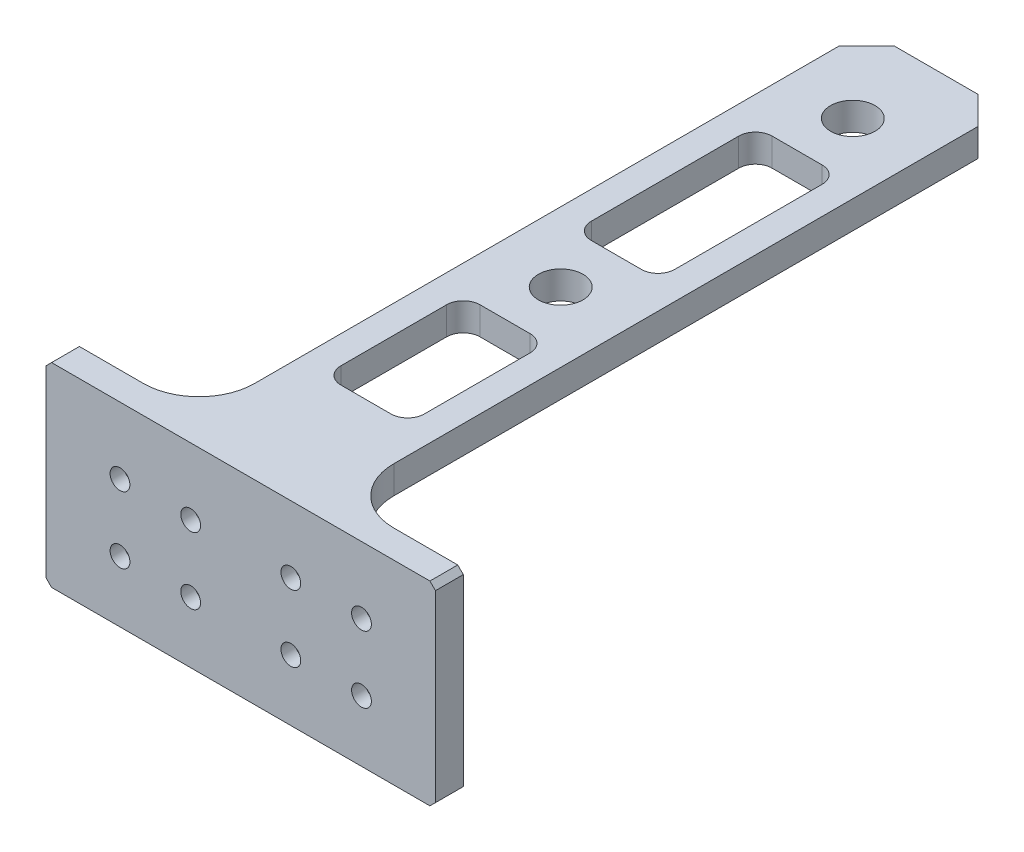
from build123d import *

# Parameters (mm, degrees)
BOSS_EXTRUDE1_DEPTH = 5
CHAMFER1_SIZE       = 5
BOSS_EXTRUDE3_DEPTH = 30
HOLE1_D             = 3.556
HOLE1_CBORE_D       = 6.858
HOLE1_CBORE_DEPTH   = 2.54
SKETCH9_R           = 4
CUT_EXTRUDE2_DEPTH  = 78.661122835
SKETCH10_W          = 15
SKETCH10_H          = 32.5
CUT_EXTRUDE3_DEPTH  = 78.661122835
CUT_EXTRUDE4_DEPTH  = 79.819413852
FILLET5_R           = 10
SKETCH13_W          = 15
SKETCH13_H          = 25
CUT_EXTRUDE5_DEPTH  = 78.661122835
FILLET3_R           = 3
CHAMFER3_SIZE       = 1


with BuildPart() as part:
    # Sketch1 → Boss-Extrude1 (new body)
    with BuildSketch(Plane(origin=(0, 0, 0), x_dir=(1, 0, 0), z_dir=(0, 1, 0))):
        Polygon((-12.5, 62.5), (-12.5, -57.5), (-35, -57.5), (-35, -62.5), (35, -62.5), (35, -57.5), (12.5, -57.5), (12.5, 62.5), align=None)
    extrude(amount=BOSS_EXTRUDE1_DEPTH)

    # Chamfer1
    chamfer1_edges = [part.edges().sort_by_distance(p)[0] for p in [
        (-12.5, 2.5, -62.5),
        (12.5, 2.5, -62.5),
    ]]
    chamfer(chamfer1_edges, length=CHAMFER1_SIZE)

    # Sketch5 → Boss-Extrude3 (add)
    with BuildSketch(Plane(origin=(0, 0, 0), x_dir=(-1, 0, 0), z_dir=(0, -1, 0))):
        Polygon((-35, -57.5), (-35, -62.5), (35, -62.5), (35, -57.5), (2.5, -57.5), (2.5, -42.5), (-2.5, -42.5), (-2.5, -57.5), align=None)
    extrude(amount=BOSS_EXTRUDE3_DEPTH)

    # Hole1 (through all)
    with Locations(Plane(origin=(0, 0, 57.5), x_dir=(-1, 0, 0), z_dir=(0, 0, -1))):
        with Locations((-21.7, -7), (-9, -7), (9, -7), (21.7, -7), (-9, -19), (-21.7, -19), (9, -19), (21.7, -19)):
            CounterBoreHole(HOLE1_D / 2, HOLE1_CBORE_D / 2, HOLE1_CBORE_DEPTH)

    # Sketch9 → Cut-Extrude2 (cut, through all)
    with BuildSketch(Plane.XZ):
        with Locations((0, -47.5)):
            Circle(SKETCH9_R)
        with Locations((0, 5)):
            Circle(SKETCH9_R)
    extrude(amount=-CUT_EXTRUDE2_DEPTH, mode=Mode.SUBTRACT)

    # Sketch10 → Cut-Extrude3 (cut, through all)
    with BuildSketch(Plane.XZ):
        with Locations((0, -21.25)):
            Rectangle(SKETCH10_W, SKETCH10_H)
    extrude(amount=-CUT_EXTRUDE3_DEPTH, mode=Mode.SUBTRACT)

    # Sketch12 → Cut-Extrude4 (cut, through all)
    with BuildSketch(Plane.ZY.offset(2.5)):
        with BuildLine():
            Line((51.5, -5), (51.5, -25))
            ThreePointArc((51.5, -25), (50, -26.5), (48.5, -25))
            Line((48.5, -25), (48.5, -5))
            ThreePointArc((48.5, -5), (50, -3.5), (51.5, -5))
        make_face()
    extrude(amount=-CUT_EXTRUDE4_DEPTH, mode=Mode.SUBTRACT)

    # Fillet5
    fillet5_edges = [part.edges().sort_by_distance(p)[0] for p in [
        (-12.5, 2.5, 57.5),
        (12.5, 2.5, 57.5),
    ]]
    fillet(fillet5_edges, radius=FILLET5_R)

    # Sketch13 → Cut-Extrude5 (cut, through all)
    with BuildSketch(Plane.XZ):
        with Locations((0, 27.5)):
            Rectangle(SKETCH13_W, SKETCH13_H)
    extrude(amount=-CUT_EXTRUDE5_DEPTH, mode=Mode.SUBTRACT)

    # Fillet3
    fillet3_edges = [part.edges().sort_by_distance(p)[0] for p in [
        (7.5, 2.5, -5),
        (-7.5, 2.5, -5),
        (-7.5, 2.5, -37.5),
        (7.5, 2.5, -37.5),
        (-7.5, 2.5, 15),
        (-7.5, 2.5, 40),
        (7.5, 2.5, 40),
        (7.5, 2.5, 15),
    ]]
    fillet(fillet3_edges, radius=FILLET3_R)

    # Chamfer3
    chamfer3_edges = [part.edges().sort_by_distance(p)[0] for p in [
        (35, 5, 60),
        (-35, 5, 60),
        (35, -30, 60),
        (-35, -30, 60),
        (0, -30, 42.5),
    ]]
    chamfer(chamfer3_edges, length=CHAMFER3_SIZE)


solid = part.part
